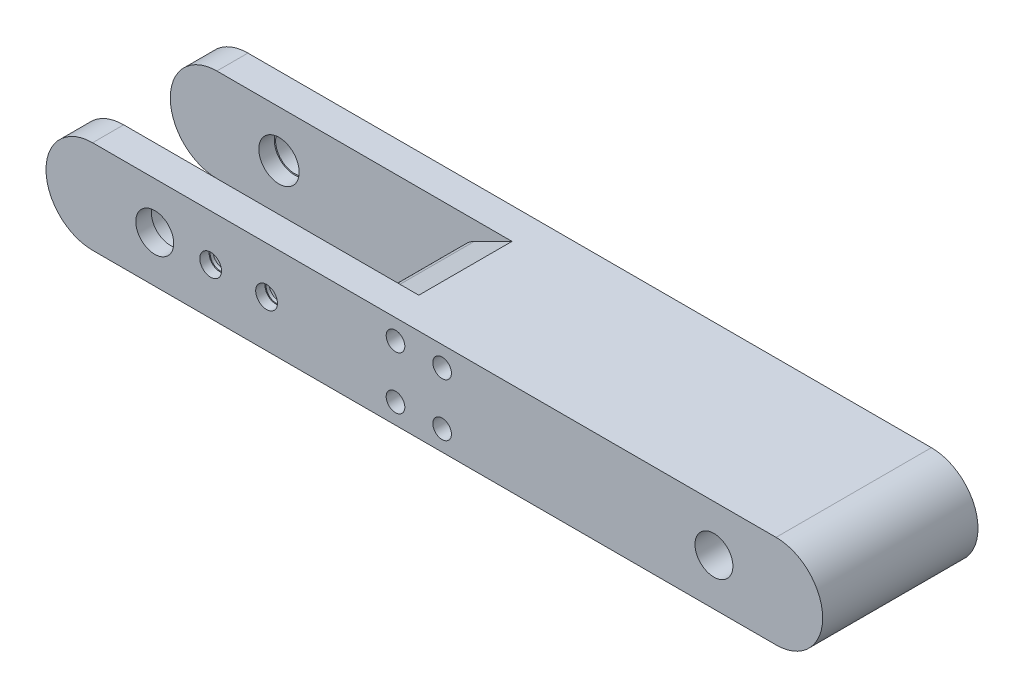
from build123d import *

# Parameters (mm, degrees)
SKETCH1_R           = 6.1
BOSS_EXTRUDE1_DEPTH = 25
SKETCH2_W           = 160
SKETCH2_H           = 30
CUT_EXTRUDE1_DEPTH  = 50
CUT_EXTRUDE5_DEPTH  = 30
CUT_EXTRUDE7_DEPTH  = 30
FILLET3_R           = 10
SKETCH8_R           = 3
CUT_EXTRUDE8_DEPTH  = 20
SKETCH9_R           = 3.15
CUT_EXTRUDE9_DEPTH  = 4
SKETCH10_R          = 3.5
CUT_EXTRUDE10_DEPTH = 3
SKETCH11_R          = 6.5
CUT_EXTRUDE11_DEPTH = 5
CUT_EXTRUDE12_START = -5
SKETCH12_R          = 6.5
CUT_EXTRUDE12_DEPTH = 5


with BuildPart() as part:
    # Sketch1 → Boss-Extrude1 (new, symmetric)
    with BuildSketch(Plane.XY):
        with BuildLine():
            Line((-110, -15), (110, -15))
            ThreePointArc((110, -15), (125, 0), (110, 15))
            Line((110, 15), (-110, 15))
            ThreePointArc((-110, 15), (-125, 0), (-110, -15))
        make_face()
        with Locations((-90, 0)):
            Circle(SKETCH1_R, mode=Mode.SUBTRACT)
        with Locations((90, 0)):
            Circle(SKETCH1_R, mode=Mode.SUBTRACT)
    extrude(amount=BOSS_EXTRUDE1_DEPTH, both=True)

    # Sketch2 → Cut-Extrude1 (cut)
    with BuildSketch(Plane(origin=(0, 15, 0), x_dir=(1, 0, 0), z_dir=(0, 1, 0))):
        with Locations((-125, 0)):
            Rectangle(SKETCH2_W, SKETCH2_H)
    extrude(amount=-CUT_EXTRUDE1_DEPTH, mode=Mode.SUBTRACT)

    # Sketch4 → Cut-Extrude5 (cut)
    with BuildSketch(Plane.XY.offset(15)):
        Polygon((-45, 15), (-45, 0), (-15, 15), align=None)
    extrude(amount=-CUT_EXTRUDE5_DEPTH, mode=Mode.SUBTRACT)

    # Sketch7 → Cut-Extrude7 (cut)
    with BuildSketch(Plane(origin=(0, 0, 15), x_dir=(-1, 0, 0), z_dir=(0, 0, -1))):
        Polygon((45, 0), (45, -15), (15, -15), align=None)
    extrude(amount=CUT_EXTRUDE7_DEPTH, mode=Mode.SUBTRACT)

    # Fillet3
    fillet3_edges = [part.edges().sort_by_distance(p)[0] for p in [
        (-45, 0, 0),
    ]]
    fillet(fillet3_edges, radius=FILLET3_R)

    # Sketch8 → Cut-Extrude8 (cut)
    with BuildSketch(Plane.XY.offset(25)):
        with Locations((-12.5, 8.5)):
            Circle(SKETCH8_R)
        with Locations((2.5, 8.5)):
            Circle(SKETCH8_R)
        with Locations(Location((2.5, -8.5, 0), (0, 0, 180))):
            Circle(SKETCH8_R)
        with Locations(Location((-12.5, -8.5, 0), (0, 0, 180))):
            Circle(SKETCH8_R)
    extrude(amount=-CUT_EXTRUDE8_DEPTH, mode=Mode.SUBTRACT)

    # Sketch9 → Cut-Extrude9 (cut)
    with BuildSketch(Plane.XY.offset(25)):
        with Locations((-72, 0)):
            Circle(SKETCH9_R)
        with Locations((-54, 0)):
            Circle(SKETCH9_R)
    extrude(amount=-CUT_EXTRUDE9_DEPTH, mode=Mode.SUBTRACT)

    # Sketch10 → Cut-Extrude10 (cut)
    with BuildSketch(Plane.XY.offset(25)):
        with Locations((-72, 0)):
            Circle(SKETCH10_R)
        with Locations((-54, 0)):
            Circle(SKETCH10_R)
    extrude(amount=-CUT_EXTRUDE10_DEPTH, mode=Mode.SUBTRACT)

    # Sketch11 → Cut-Extrude11 (cut)
    with BuildSketch(Plane(origin=(0, 0, 15), x_dir=(-1, 0, 0), z_dir=(0, 0, -1))):
        with Locations((90, 0)):
            Circle(SKETCH11_R)
    extrude(amount=-CUT_EXTRUDE11_DEPTH, mode=Mode.SUBTRACT)

    # Sketch12 → Cut-Extrude12 (cut)
    with BuildSketch(Plane.XY.offset(-15).offset(CUT_EXTRUDE12_START)):
        with Locations(Location((-90, 0, 0), (0, 0, 180))):
            Circle(SKETCH12_R)
    extrude(amount=CUT_EXTRUDE12_DEPTH, mode=Mode.SUBTRACT)


solid = part.part
